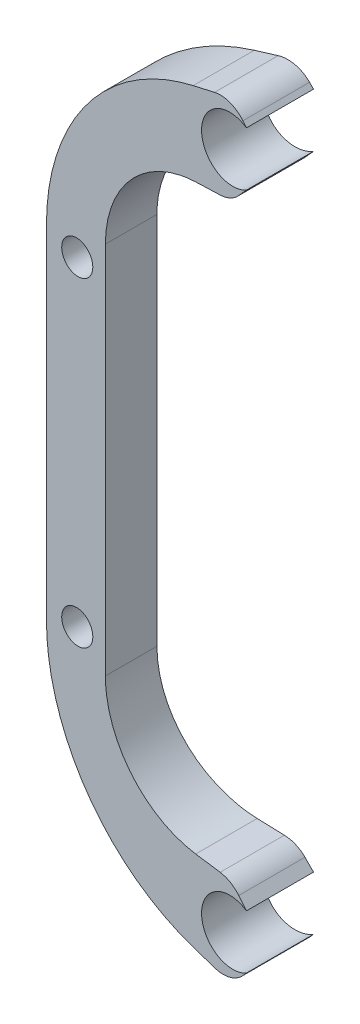
from build123d import *

# Parameters (mm, degrees)
SKETCH_1_R               = 1.1
EXTRUDE_2_DEPTH          = 4.5
FILLET_1_R               = 7
FILLET_2_R               = 14
FILLET_3_R               = 2
CUT_EXTRUDE_1_DEPTH      = 33.524221985
CUT_EXTRUDE_1_DEPTH_BACK = 33.524221985


with BuildPart() as part:
    # 草图1 → 凸台-拉伸2 (new body)
    with BuildSketch(Plane.XY):
        with BuildLine():
            Line((6.017486991, 19.788810031), (-7.057549395, 16.285364591))
            Line((-7.057549395, 16.285364591), (-7.057549395, -16.139577348))
            Line((-7.057549395, -16.139577348), (-7.057549395, -28.167744528))
            Line((-7.057549395, -28.167744528), (6.017486991, -31.671189969))
            Line((6.017486991, -31.671189969), (7.089384541, -30.477023749))
            ThreePointArc((7.089384541, -30.477023749), (3.917486991, -28.671189969), (7.089384541, -26.865356188))
            Line((7.089384541, -26.865356188), (6.017486991, -25.671189969))
            Line((6.017486991, -25.671189969), (-2.887475269, -24.892106722))
            Line((-2.887475269, -24.892106722), (-2.887475269, 13.009726784))
            Line((-2.887475269, 13.009726784), (6.017486991, 13.788810031))
            Line((6.017486991, 13.788810031), (7.089384541, 14.982976251))
            ThreePointArc((7.089384541, 14.982976251), (3.917486991, 16.788810031), (7.089384541, 18.594643812))
            Line((7.089384541, 18.594643812), (6.017486991, 19.788810031))
        make_face()
        with Locations((-4.879152463, 4.788810031)):
            Circle(SKETCH_1_R, mode=Mode.SUBTRACT)
        with Locations((-4.879152463, -16.671189969)):
            Circle(SKETCH_1_R, mode=Mode.SUBTRACT)
    extrude(amount=EXTRUDE_2_DEPTH)

    # 圆角1
    fillet_1_edges = [part.edges().sort_by_distance(p)[0] for p in [
        (-2.887475269, 13.009726784, 2.25),
        (-2.887475269, -24.892106722, 2.25),
    ]]
    fillet(fillet_1_edges, radius=FILLET_1_R)

    # 圆角2
    fillet_2_edges = [part.edges().sort_by_distance(p)[0] for p in [
        (-7.057549395, -28.167744528, 2.25),
        (-7.057549395, 16.285364591, 2.25),
    ]]
    fillet(fillet_2_edges, radius=FILLET_2_R)

    # 圆角3
    fillet_3_edges = [part.edges().sort_by_distance(p)[0] for p in [
        (6.017486991, 13.788810031, 2.25),
        (6.017486991, -25.671189969, 2.25),
        (6.017486991, -31.671189969, 2.25),
        (6.017486991, 19.788810031, 2.25),
    ]]
    fillet(fillet_3_edges, radius=FILLET_3_R)

    # 草图2 → 切除-拉伸1 (cut, two sides: drawn at the far end of the back side and taken through both)
    with BuildSketch(Plane(origin=(0, 0, 0), x_dir=(1, 0, 0), z_dir=(0, 1, 0)).offset(-CUT_EXTRUDE_1_DEPTH_BACK)):
        Polygon((-9.937735325, -0.89235354), (-9.653427695, 2.8886559), (6.091848462, 2.8886559), (7.089384541, 0), (-4.928773799, -0.62984499), (-9.504604651, -0.62984499), align=None)
        Polygon((7.089384541, -4.5), (-9.927872999, -3.608163323), (-9.667318366, -5.613598375), (7.089384541, -5.407507841), align=None)
    extrude(amount=CUT_EXTRUDE_1_DEPTH + CUT_EXTRUDE_1_DEPTH_BACK, mode=Mode.SUBTRACT)


solid = part.part
